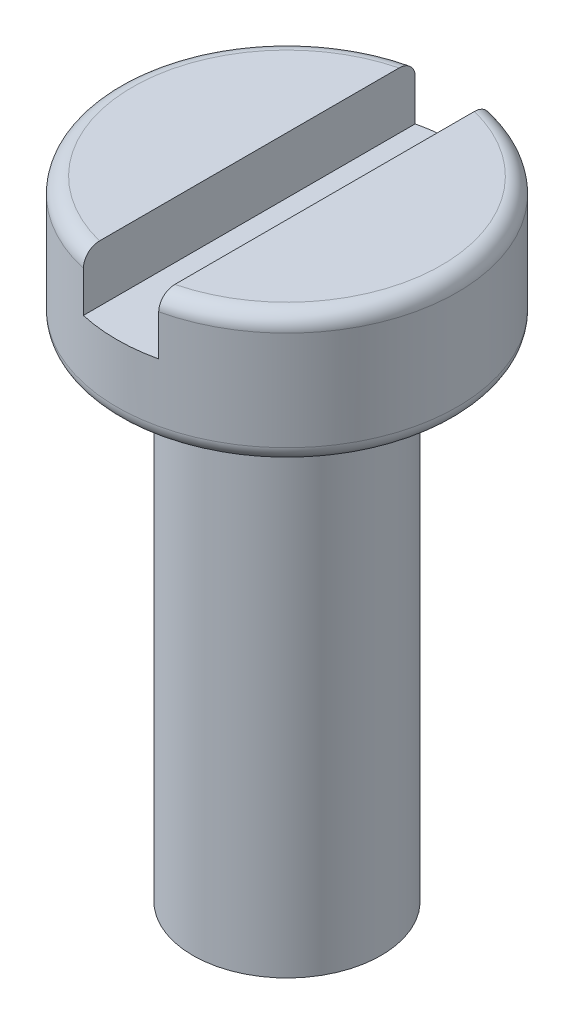
from build123d import *

# Parameters (mm, degrees)
SKETCH1_R             = 2.71
BOSS_EXTRUDE1_DEPTH   = 10
SKETCH2_OUTSIDE_W     = 9.94
SKETCH2_OUTSIDE_H     = 9.94
SKETCH2_OUTSIDE_R     = 1.5
CUT_EXTRUDE1_DEPTH    = 7.92
FILLET1_R             = 0.25
FILLET2_R             = 0.15
SKETCH3_W             = 1.2
SKETCH3_H             = 5.422046684
CUT_EXTRUDE2_DEPTH    = 0.9
BODY_MOVE_COPY1_ANGLE = 180


with BuildPart() as part:
    # Sketch1 → Boss-Extrude1 (new body)
    with BuildSketch(Plane(origin=(0, 0, 0), x_dir=(1, 0, 0), z_dir=(0, 1, 0))):
        with Locations(Location((0, 0, 0), (0, 0, 270))):
            Circle(SKETCH1_R)
    extrude(amount=BOSS_EXTRUDE1_DEPTH)

    # Sketch2 outside → Cut-Extrude1 (cut)
    with BuildSketch(Plane(origin=(0, 10, 0), x_dir=(1, 0, 0), z_dir=(0, 1, 0))):
        Rectangle(SKETCH2_OUTSIDE_W, SKETCH2_OUTSIDE_H)
        with Locations(Location((0, 0, 0), (0, 0, 270))):
            Circle(SKETCH2_OUTSIDE_R, mode=Mode.SUBTRACT)
    extrude(amount=-CUT_EXTRUDE1_DEPTH, mode=Mode.SUBTRACT)

    # Fillet1
    fillet1_edges = [part.edges().sort_by_distance(p)[0] for p in [
        (0, 0, -2.71),
        (0, 2.08, -2.71),
    ]]
    fillet(fillet1_edges, radius=FILLET1_R)

    # Fillet2
    fillet2_edges = [part.edges().sort_by_distance(p)[0] for p in [
        (0, 2.08, -1.5),
    ]]
    fillet(fillet2_edges, radius=FILLET2_R)

    # Sketch3 → Cut-Extrude2 (cut)
    with BuildSketch(Plane.XZ):
        Rectangle(SKETCH3_W, SKETCH3_H)
    extrude(amount=-CUT_EXTRUDE2_DEPTH, mode=Mode.SUBTRACT)


with BuildPart() as part_1:
    # Body-Move/Copy1: moved
    add(part.part.rotate(Axis((0, 10, 0), (1, 0, 0)), BODY_MOVE_COPY1_ANGLE))


solid = part_1.part
